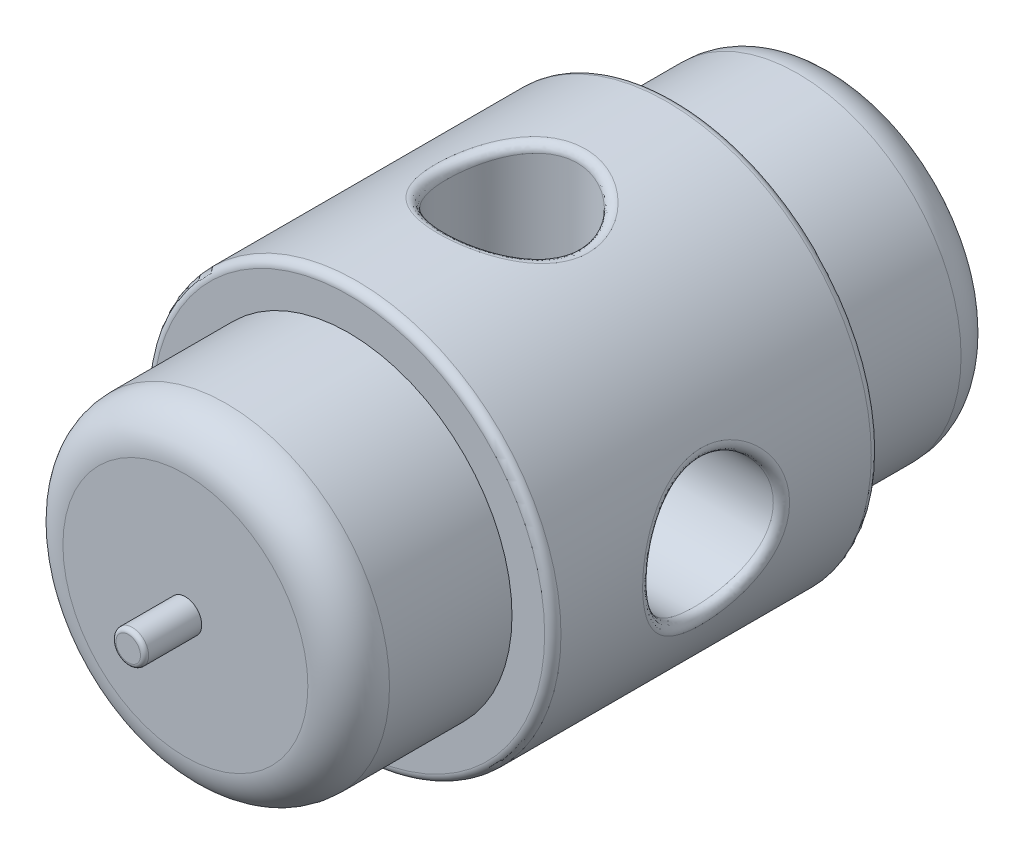
from build123d import *

# Parameters (mm, degrees)
SKETCH20_R           = 25
BOSS_EXTRUDE6_DEPTH  = 40
SKETCH21_R           = 8
CUT_EXTRUDE2_DEPTH   = 26
CIRPATTERN1_COUNT    = 2
CIRPATTERN1_ANGLE    = 90
SKETCH24_R           = 20
BOSS_EXTRUDE7_DEPTH  = 20
FILLET3_R            = 5
SKETCH25_R           = 2
BOSS_EXTRUDE8_DEPTH  = 7
FILLET4_R            = 0.5
FILLET5_R            = 1
SKETCH26_R           = 20
BOSS_EXTRUDE9_DEPTH  = 20
SKETCH27_R           = 2
BOSS_EXTRUDE10_DEPTH = 7
FILLET6_R            = 0.5
FILLET7_R            = 5


with BuildPart() as part:
    # Sketch20 → Boss-Extrude6 (new body)
    with BuildSketch(Plane.XY.offset(150)):
        with Locations((200, 200)):
            Circle(SKETCH20_R)
    extrude(amount=-BOSS_EXTRUDE6_DEPTH)

    # Sketch21 → Cut-Extrude2 (cut)
    with BuildSketch(Plane(origin=(0, 210, 0), x_dir=(1, 0, 0), z_dir=(0, 1, 0))):
        with Locations((200, -130)):
            Circle(SKETCH21_R)
    cut_extrude2 = extrude(amount=CUT_EXTRUDE2_DEPTH, mode=Mode.SUBTRACT)

    # CirPattern1: Cut-Extrude2 ×2 about axis
    cirpattern1_axis = Axis((200, 200, 110), (0, 0, -1))
    for i in range(1, CIRPATTERN1_COUNT):
        add(cut_extrude2.rotate(cirpattern1_axis, i * CIRPATTERN1_ANGLE / (CIRPATTERN1_COUNT - 1)), mode=Mode.SUBTRACT)

    # Fillet5
    fillet5_edges = [part.edges().sort_by_distance(p)[0] for p in [
        (223.685438565, 208, 130),
        (192, 223.685438565, 130),
        (175, 200, 110),
        (175, 200, 150),
    ]]
    fillet(fillet5_edges, radius=FILLET5_R)


with BuildPart() as body_2:
    # Sketch24 → Boss-Extrude7 (new body)
    with BuildSketch(Plane.XY.offset(150)):
        with Locations((200, 200)):
            Circle(SKETCH24_R)
    extrude(amount=BOSS_EXTRUDE7_DEPTH)

    # Fillet3
    fillet3_edges = [body_2.edges().sort_by_distance(p)[0] for p in [
        (180, 200, 170),
    ]]
    fillet(fillet3_edges, radius=FILLET3_R)

    # Sketch25 → Boss-Extrude8 (add)
    with BuildSketch(Plane.XY.offset(170)):
        with Locations((200, 200)):
            Circle(SKETCH25_R)
    extrude(amount=BOSS_EXTRUDE8_DEPTH)

    # Fillet4
    fillet4_edges = [body_2.edges().sort_by_distance(p)[0] for p in [
        (198, 200, 177),
    ]]
    fillet(fillet4_edges, radius=FILLET4_R)


with BuildPart() as body_3:
    # Sketch26 → Boss-Extrude9 (new body)
    with BuildSketch(Plane(origin=(0, 0, 110), x_dir=(-1, 0, 0), z_dir=(0, 0, -1))):
        with Locations((-200, 200)):
            Circle(SKETCH26_R)
    extrude(amount=BOSS_EXTRUDE9_DEPTH)

    # Sketch27 → Boss-Extrude10 (add)
    with BuildSketch(Plane(origin=(0, 0, 90), x_dir=(1, 0, 0), z_dir=(0, 0, -1))):
        with Locations((200, -200)):
            Circle(SKETCH27_R)
    extrude(amount=BOSS_EXTRUDE10_DEPTH)

    # Fillet6
    fillet6_edges = [body_3.edges().sort_by_distance(p)[0] for p in [
        (198, 200, 83),
    ]]
    fillet(fillet6_edges, radius=FILLET6_R)

    # Fillet7
    fillet7_edges = [body_3.edges().sort_by_distance(p)[0] for p in [
        (220, 200, 90),
    ]]
    fillet(fillet7_edges, radius=FILLET7_R)


solid = Compound([part.part, body_2.part, body_3.part])
